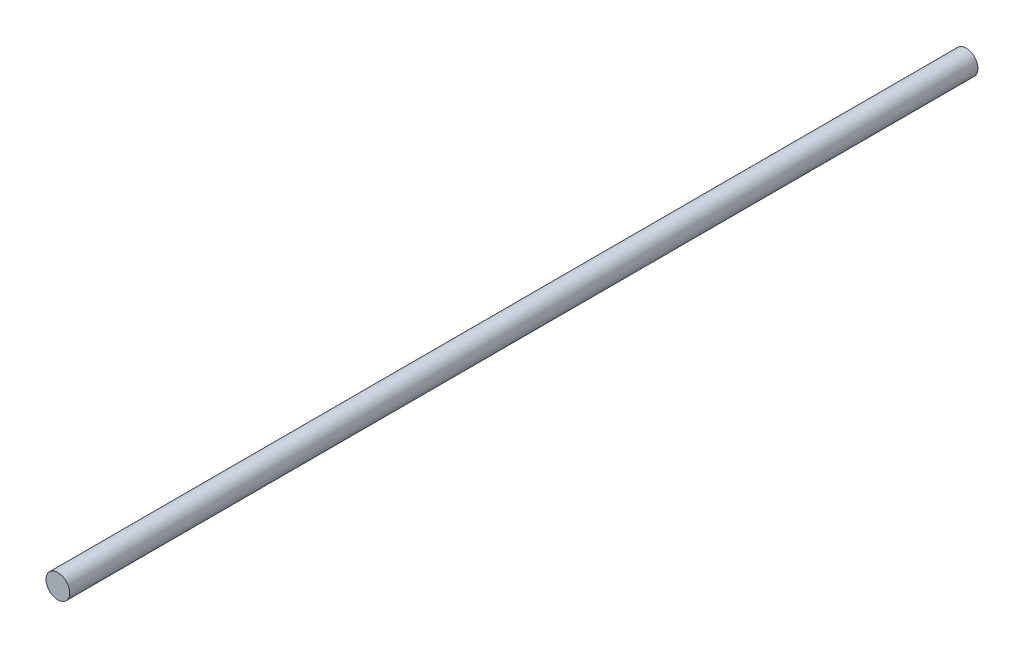
from build123d import *

# Parameters (mm, degrees)
SKETCH1_R           = 15
BOSS_EXTRUDE1_DEPTH = 1150


with BuildPart() as part:
    # Sketch1 → Boss-Extrude1 (new body)
    with BuildSketch(Plane.XY):
        Circle(SKETCH1_R)
    extrude(amount=BOSS_EXTRUDE1_DEPTH)


solid = part.part
